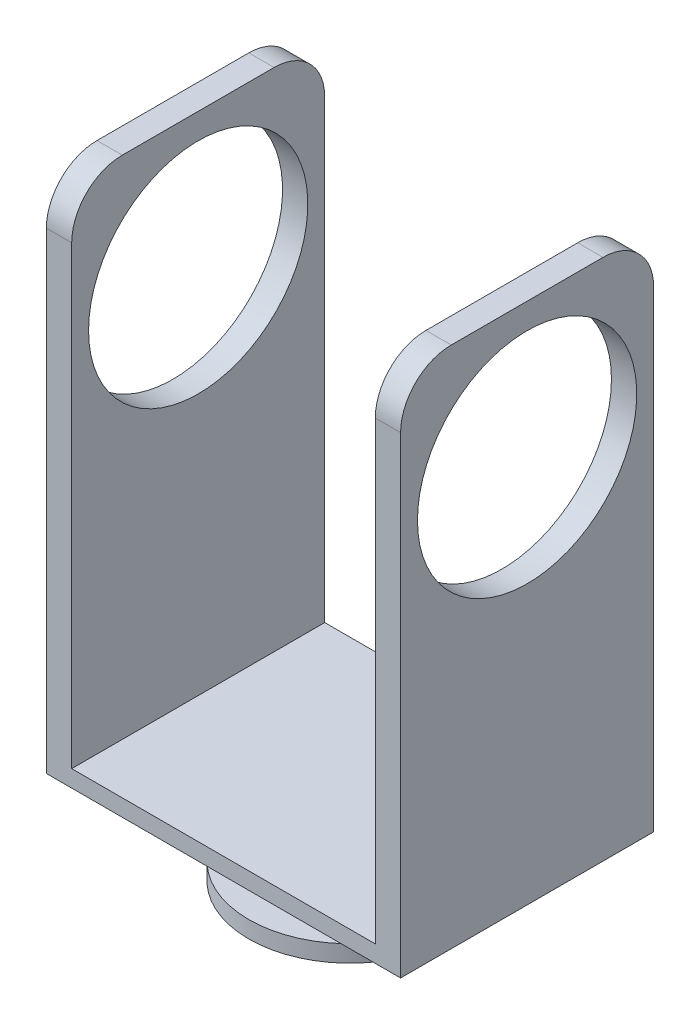
from build123d import *

# Parameters (mm, degrees)
CROQUIS1_R              = 6
SALIENTE_EXTRUIR1_DEPTH = 1
CROQUIS2_R              = 2.5
SALIENTE_EXTRUIR2_DEPTH = 3
CROQUIS3_W              = 21
CROQUIS3_H              = 15
SALIENTE_EXTRUIR3_DEPTH = 1
CROQUIS4_W              = 1.5
CROQUIS4_H              = 15
SALIENTE_EXTRUIR4_DEPTH = 30
CROQUIS5_R              = 6.5
CORTAR_EXTRUIR1_DEPTH   = 34
REDONDEO1_R             = 3


with BuildPart() as part:
    # Croquis1 → Saliente-Extruir1 (new body)
    with BuildSketch(Plane(origin=(0, 0, 0), x_dir=(1, 0, 0), z_dir=(0, 1, 0))):
        with Locations(Location((0, 0, 0), (0, 0, 270))):
            Circle(CROQUIS1_R)
    extrude(amount=SALIENTE_EXTRUIR1_DEPTH)

    # Croquis2 → Saliente-Extruir2 (add)
    with BuildSketch(Plane(origin=(0, 1, 0), x_dir=(1, 0, 0), z_dir=(0, 1, 0))):
        with Locations(Location((0, 0, 0), (0, 0, 270))):
            Circle(CROQUIS2_R)
    extrude(amount=SALIENTE_EXTRUIR2_DEPTH)

    # Croquis3 → Saliente-Extruir3 (add)
    with BuildSketch(Plane(origin=(0, 4, 0), x_dir=(1, 0, 0), z_dir=(0, 1, 0))):
        Rectangle(CROQUIS3_W, CROQUIS3_H)
    extrude(amount=SALIENTE_EXTRUIR3_DEPTH)

    # Croquis4 → Saliente-Extruir4 (add)
    with BuildSketch(Plane(origin=(0, 5, 0), x_dir=(1, 0, 0), z_dir=(0, 1, 0))):
        with Locations((-9.75, 0)):
            Rectangle(CROQUIS4_W, CROQUIS4_H)
        with Locations((9.75, 0)):
            Rectangle(CROQUIS4_W, CROQUIS4_H)
    extrude(amount=SALIENTE_EXTRUIR4_DEPTH)

    # Croquis5 → Cortar-Extruir1 (cut)
    with BuildSketch(Plane.ZY.offset(10.5)):
        with Locations((0, 26.988393785)):
            Circle(CROQUIS5_R)
    extrude(amount=-CORTAR_EXTRUIR1_DEPTH, mode=Mode.SUBTRACT)

    # Redondeo1
    redondeo1_edges = [part.edges().sort_by_distance(p)[0] for p in [
        (-9.75, 35, 7.5),
        (-9.75, 35, -7.5),
        (9.75, 35, -7.5),
        (9.75, 35, 7.5),
    ]]
    fillet(redondeo1_edges, radius=REDONDEO1_R)


solid = part.part
